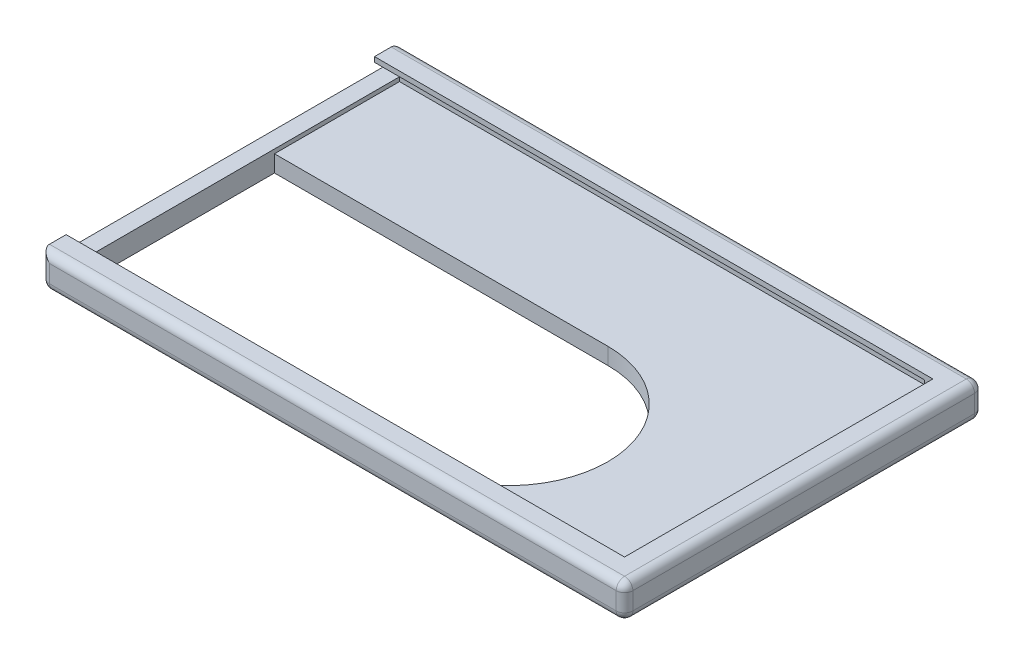
from build123d import *

# Parameters (mm, degrees)
BOSS_EXTRUDE1_DEPTH      = 2
SKETCH1_3_W              = 70
SKETCH1_3_H              = 43
BOSS_EXTRUDE2_DEPTH      = 4
SKETCH1_5_W              = 40
SKETCH1_5_H              = 24
CUT_EXTRUDE4_DEPTH       = 2
CUT_EXTRUDE5_REACH       = 81.505
SKETCH2_W                = 39
SKETCH2_H                = 1.5
BOSS_EXTRUDE3_DEPTH      = 0.1
BOSS_EXTRUDE3_DEPTH_BACK = 0.5
FILLET1_R                = 1


with BuildPart() as part:
    # Sketch1 → Boss-Extrude1 (new body)
    with BuildSketch(Plane(origin=(0, 0, 0), x_dir=(1, 0, 0), z_dir=(0, 1, 0))):
        Polygon((0, 0), (64, 0), (64, -1), (66, -1), (66, -38), (64, -38), (64, -39), (0, -39), align=None)
    extrude(amount=BOSS_EXTRUDE1_DEPTH)

    # Sketch1<3> → Boss-Extrude2 (add)
    with BuildSketch(Plane(origin=(0, 0, 0), x_dir=(1, 0, 0), z_dir=(0, 1, 0))):
        with Locations((33, -19.5)):
            Rectangle(SKETCH1_3_W, SKETCH1_3_H)
        Polygon((0, 0), (64, 0), (64, -1), (66, -1), (66, -38), (64, -38), (64, -39), (0, -39), align=None, mode=Mode.SUBTRACT)
    extrude(amount=BOSS_EXTRUDE2_DEPTH)

    # Sketch1<5> → Cut-Extrude4 (cut)
    with BuildSketch(Plane(origin=(0, 0, 0), x_dir=(1, 0, 0), z_dir=(0, 1, 0))):
        with Locations((20, -27)):
            Rectangle(SKETCH1_5_W, SKETCH1_5_H)
        with BuildLine():
            ThreePointArc((40, -15), (52, -27), (40, -39))
            Line((40, -39), (40, -15))
        make_face()
    extrude(amount=CUT_EXTRUDE4_DEPTH, mode=Mode.SUBTRACT)

    # Sketch2 → Cut-Extrude5 (cut, up to next)
    with BuildSketch(Plane(origin=(0, 0, 0), x_dir=(0, 0, -1), z_dir=(1, 0, 0)), mode=Mode.PRIVATE) as cut_extrude5_sk1:
        with Locations((-19.5, 3.25)):
            Rectangle(SKETCH2_W, SKETCH2_H)
    cut_extrude5_tool1 = extrude(cut_extrude5_sk1.sketch, amount=-CUT_EXTRUDE5_REACH, mode=Mode.PRIVATE) & part.part
    add(cut_extrude5_tool1.solids().sort_by_distance((0, 3.25, 19.5))[0], mode=Mode.SUBTRACT)

    # Sketch3 → Boss-Extrude3 (add, two sides: drawn at the far end of the back side and taken through both)
    with BuildSketch(Plane(origin=(0, 4, 0), x_dir=(1, 0, 0), z_dir=(0, 1, 0)).offset(-BOSS_EXTRUDE3_DEPTH_BACK)):
        Polygon((-2, -41), (68, -41), (68, 2), (-2, 2), (-2, -1), (65, -1), (65, -38), (-2, -38), align=None)
    extrude(amount=BOSS_EXTRUDE3_DEPTH + BOSS_EXTRUDE3_DEPTH_BACK)

    # Fillet1
    fillet1_edges = [part.edges().sort_by_distance(p)[0] for p in [
        (33, 4.1, 41),
        (68, 4.1, 19.5),
        (33, 4.1, -2),
        (68, 2.05, -2),
        (-2, 0, 19.5),
        (-2, 2.05, -2),
        (33, 0, 41),
        (-2, 2.05, 41),
        (68, 2.05, 41),
        (33, 0, -2),
        (68, 0, 19.5),
    ]]
    fillet(fillet1_edges, radius=FILLET1_R)


solid = part.part
